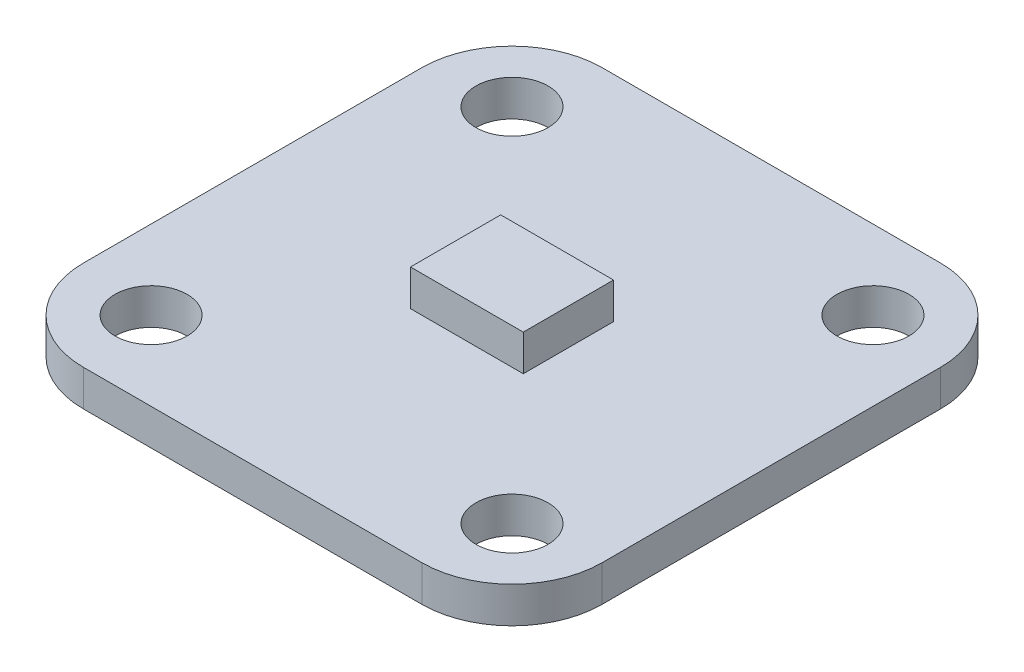
from build123d import *

# Parameters (mm, degrees)
SKETCH_1_W          = 23
SKETCH_1_H          = 23
EXTRUDE_1_DEPTH     = 1.6
SKETCH_2_W          = 5
SKETCH_2_H          = 4
EXTRUDE_2_DEPTH     = 1.6
FILLET_1_R          = 4
CUT_EXTRUDE_1_REACH = 18.575
SKETCH_3_R          = 1.6


with BuildPart() as part:
    # 草图1 → 凸台-拉伸1 (new body)
    with BuildSketch(Plane(origin=(0, 0, 0), x_dir=(1, 0, 0), z_dir=(0, 1, 0))):
        Rectangle(SKETCH_1_W, SKETCH_1_H)
    extrude(amount=EXTRUDE_1_DEPTH)

    # 草图2 → 凸台-拉伸2 (add)
    with BuildSketch(Plane(origin=(0, 1.6, 0), x_dir=(1, 0, 0), z_dir=(0, 1, 0))):
        Rectangle(SKETCH_2_W, SKETCH_2_H)
    extrude(amount=EXTRUDE_2_DEPTH)

    # 圆角1
    fillet_1_edges = [part.edges().sort_by_distance(p)[0] for p in [
        (11.5, 0.8, 11.5),
        (-11.5, 0.8, 11.5),
        (-11.5, 0.8, -11.5),
        (11.5, 0.8, -11.5),
    ]]
    fillet(fillet_1_edges, radius=FILLET_1_R)

    # 草图3 → 切除-拉伸1 (cut, up to next)
    with BuildSketch(Plane.XZ, mode=Mode.PRIVATE) as cut_extrude_1_sk1:
        with Locations(Location((-8, 8, 0), (0, 0, 270))):
            Circle(SKETCH_3_R)
    cut_extrude_1_tool1 = extrude(cut_extrude_1_sk1.sketch, amount=-CUT_EXTRUDE_1_REACH, mode=Mode.PRIVATE) & part.part
    # 草图3 → 切除-拉伸1 (cut, up to next)
    with BuildSketch(Plane.XZ, mode=Mode.PRIVATE) as cut_extrude_1_sk2:
        with Locations(Location((8, 8, 0), (0, 0, 270))):
            Circle(SKETCH_3_R)
    cut_extrude_1_tool2 = extrude(cut_extrude_1_sk2.sketch, amount=-CUT_EXTRUDE_1_REACH, mode=Mode.PRIVATE) & part.part
    # 草图3 → 切除-拉伸1 (cut, up to next)
    with BuildSketch(Plane.XZ, mode=Mode.PRIVATE) as cut_extrude_1_sk3:
        with Locations(Location((8, -8, 0), (0, 0, 270))):
            Circle(SKETCH_3_R)
    cut_extrude_1_tool3 = extrude(cut_extrude_1_sk3.sketch, amount=-CUT_EXTRUDE_1_REACH, mode=Mode.PRIVATE) & part.part
    # 草图3 → 切除-拉伸1 (cut, up to next)
    with BuildSketch(Plane.XZ, mode=Mode.PRIVATE) as cut_extrude_1_sk4:
        with Locations(Location((-8, -8, 0), (0, 0, 270))):
            Circle(SKETCH_3_R)
    cut_extrude_1_tool4 = extrude(cut_extrude_1_sk4.sketch, amount=-CUT_EXTRUDE_1_REACH, mode=Mode.PRIVATE) & part.part
    add(cut_extrude_1_tool1.solids().sort_by_distance((-8, 0, 8))[0], mode=Mode.SUBTRACT)
    add(cut_extrude_1_tool2.solids().sort_by_distance((8, 0, 8))[0], mode=Mode.SUBTRACT)
    add(cut_extrude_1_tool3.solids().sort_by_distance((8, 0, -8))[0], mode=Mode.SUBTRACT)
    add(cut_extrude_1_tool4.solids().sort_by_distance((-8, 0, -8))[0], mode=Mode.SUBTRACT)


solid = part.part
